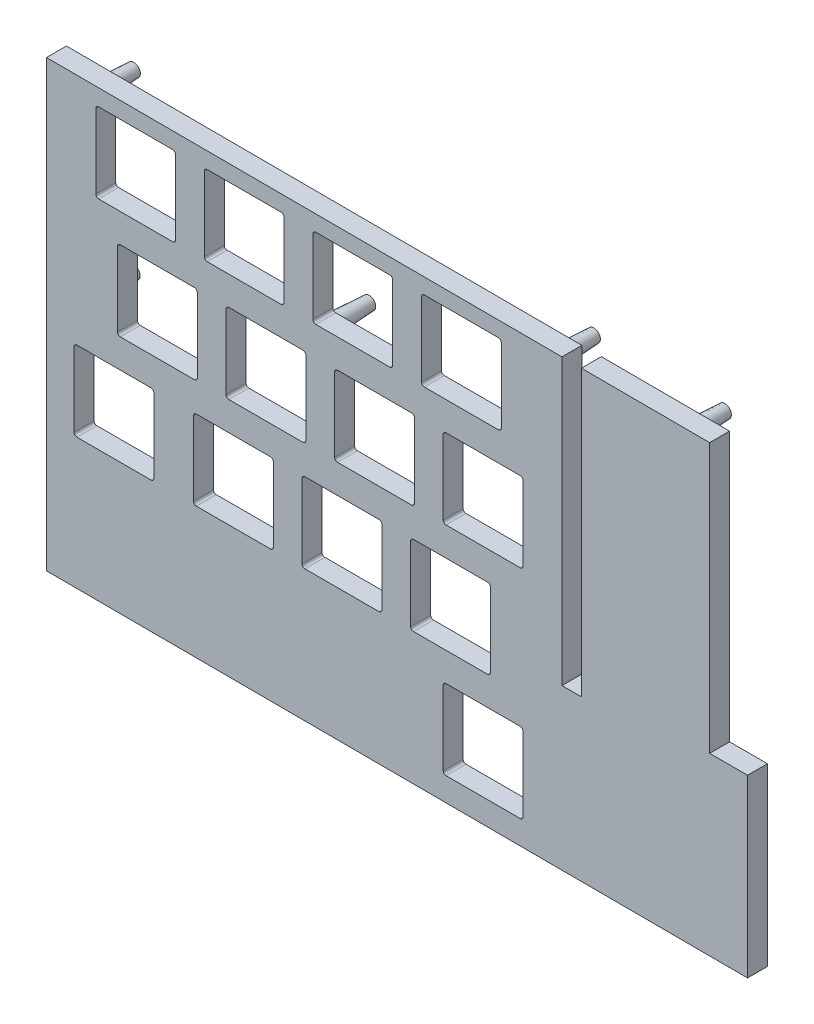
from build123d import *

# Parameters (mm, degrees)
BOSS_EXTRUDE1_DEPTH           = 3.5
SKETCH3_W                     = 3.410478587
SKETCH3_H                     = 49.945504098
SKETCH3_W_2                   = 6.648180457
SKETCH3_H_2                   = 47.210710856
CUT_EXTRUDE2_DEPTH            = 5
SKETCH4_R                     = 3.544423748
SKETCH4_R_2                   = 2.369129831
BOSS_EXTRUDE2_DEPTH           = 8
SKETCH6_R                     = 1.5
SKETCH6_R_2                   = 0.176517674
BOSS_EXTRUDE3_DEPTH           = 7
BOSS_EXTRUDE3_DRAFT           = 3
SKETCH6_R_3                   = 1.48523274
SKETCH6_R_4                   = 0.207886925
BOSS_EXTRUDE3_PROFILE_2_DEPTH = 7
BOSS_EXTRUDE3_PROFILE_2_DRAFT = 3
SKETCH6_R_5                   = 1.502064375
SKETCH6_R_6                   = 0.195980892
BOSS_EXTRUDE3_PROFILE_3_DEPTH = 7
BOSS_EXTRUDE3_PROFILE_3_DRAFT = 3
SKETCH6_R_7                   = 1.509002503
SKETCH6_R_8                   = 0.248242845
BOSS_EXTRUDE3_PROFILE_4_DEPTH = 7
BOSS_EXTRUDE3_PROFILE_4_DRAFT = 3
SKETCH6_R_9                   = 0.26800322
BOSS_EXTRUDE3_PROFILE_5_DEPTH = 7
BOSS_EXTRUDE3_PROFILE_5_DRAFT = 3
SKETCH6_R_10                  = 0.26114424
BOSS_EXTRUDE3_PROFILE_6_DEPTH = 7
BOSS_EXTRUDE3_PROFILE_6_DRAFT = 3
SKETCH6_R_11                  = 0.245265587
BOSS_EXTRUDE3_PROFILE_7_DEPTH = 7
BOSS_EXTRUDE3_PROFILE_7_DRAFT = 3
SKETCH6_R_12                  = 1.479730479
SKETCH6_R_13                  = 0.2681262
BOSS_EXTRUDE3_PROFILE_8_DEPTH = 7
BOSS_EXTRUDE3_PROFILE_8_DRAFT = 3
FILLET1_R                     = 1


with BuildPart() as part:
    # Model → Boss-Extrude1 (new body)
    with BuildSketch(Plane.XY):
        Polygon((0, -78), (123, -78.361463573), (123, -0.361463573), (0, 0), align=None)
        with BuildLine():
            Line((9.144975253, -2.923037489), (22.144975253, -2.923037489))
            ThreePointArc((22.144975253, -2.923037489), (22.498528643, -3.069484099), (22.644975253, -3.423037489))
            Line((22.644975253, -3.423037489), (22.644975253, -16.423037489))
            ThreePointArc((22.644975253, -16.423037489), (22.498528643, -16.77659088), (22.144975253, -16.923037489))
            Line((22.144975253, -16.923037489), (9.144975253, -16.923037489))
            ThreePointArc((9.144975253, -16.923037489), (8.791421862, -16.77659088), (8.644975253, -16.423037489))
            Line((8.644975253, -16.423037489), (8.644975253, -3.423037489))
            ThreePointArc((8.644975253, -3.423037489), (8.791421862, -3.069484099), (9.144975253, -2.923037489))
        make_face(mode=Mode.SUBTRACT)
        with BuildLine():
            Line((28.194975253, -2.923037489), (41.194975253, -2.923037489))
            ThreePointArc((41.194975253, -2.923037489), (41.548528643, -3.069484099), (41.694975253, -3.423037489))
            Line((41.694975253, -3.423037489), (41.694975253, -16.423037489))
            ThreePointArc((41.694975253, -16.423037489), (41.548528643, -16.77659088), (41.194975253, -16.923037489))
            Line((41.194975253, -16.923037489), (28.194975253, -16.923037489))
            ThreePointArc((28.194975253, -16.923037489), (27.841421862, -16.77659088), (27.694975253, -16.423037489))
            Line((27.694975253, -16.423037489), (27.694975253, -3.423037489))
            ThreePointArc((27.694975253, -3.423037489), (27.841421862, -3.069484099), (28.194975253, -2.923037489))
        make_face(mode=Mode.SUBTRACT)
        with BuildLine():
            Line((47.244975253, -2.923037489), (60.244975253, -2.923037489))
            ThreePointArc((60.244975253, -2.923037489), (60.598528643, -3.069484099), (60.744975253, -3.423037489))
            Line((60.744975253, -3.423037489), (60.744975253, -16.423037489))
            ThreePointArc((60.744975253, -16.423037489), (60.598528643, -16.77659088), (60.244975253, -16.923037489))
            Line((60.244975253, -16.923037489), (47.244975253, -16.923037489))
            ThreePointArc((47.244975253, -16.923037489), (46.891421862, -16.77659088), (46.744975253, -16.423037489))
            Line((46.744975253, -16.423037489), (46.744975253, -3.423037489))
            ThreePointArc((46.744975253, -3.423037489), (46.891421862, -3.069484099), (47.244975253, -2.923037489))
        make_face(mode=Mode.SUBTRACT)
        with BuildLine():
            Line((66.294975253, -2.923037489), (79.294975253, -2.923037489))
            ThreePointArc((79.294975253, -2.923037489), (79.648528643, -3.069484099), (79.794975253, -3.423037489))
            Line((79.794975253, -3.423037489), (79.794975253, -16.423037489))
            ThreePointArc((79.794975253, -16.423037489), (79.648528643, -16.77659088), (79.294975253, -16.923037489))
            Line((79.294975253, -16.923037489), (66.294975253, -16.923037489))
            ThreePointArc((66.294975253, -16.923037489), (65.941421862, -16.77659088), (65.794975253, -16.423037489))
            Line((65.794975253, -16.423037489), (65.794975253, -3.423037489))
            ThreePointArc((65.794975253, -3.423037489), (65.941421862, -3.069484099), (66.294975253, -2.923037489))
        make_face(mode=Mode.SUBTRACT)
        with BuildLine():
            Line((12.954975253, -21.973037489), (25.954975253, -21.973037489))
            ThreePointArc((25.954975253, -21.973037489), (26.308528643, -22.119484099), (26.454975253, -22.473037489))
            Line((26.454975253, -22.473037489), (26.454975253, -35.473037489))
            ThreePointArc((26.454975253, -35.473037489), (26.308528643, -35.82659088), (25.954975253, -35.973037489))
            Line((25.954975253, -35.973037489), (12.954975253, -35.973037489))
            ThreePointArc((12.954975253, -35.973037489), (12.601421862, -35.82659088), (12.454975253, -35.473037489))
            Line((12.454975253, -35.473037489), (12.454975253, -22.473037489))
            ThreePointArc((12.454975253, -22.473037489), (12.601421862, -22.119484099), (12.954975253, -21.973037489))
        make_face(mode=Mode.SUBTRACT)
        with BuildLine():
            Line((32.004975253, -21.973037489), (45.004975253, -21.973037489))
            ThreePointArc((45.004975253, -21.973037489), (45.358528643, -22.119484099), (45.504975253, -22.473037489))
            Line((45.504975253, -22.473037489), (45.504975253, -35.473037489))
            ThreePointArc((45.504975253, -35.473037489), (45.358528643, -35.82659088), (45.004975253, -35.973037489))
            Line((45.004975253, -35.973037489), (32.004975253, -35.973037489))
            ThreePointArc((32.004975253, -35.973037489), (31.651421862, -35.82659088), (31.504975253, -35.473037489))
            Line((31.504975253, -35.473037489), (31.504975253, -22.473037489))
            ThreePointArc((31.504975253, -22.473037489), (31.651421862, -22.119484099), (32.004975253, -21.973037489))
        make_face(mode=Mode.SUBTRACT)
        with BuildLine():
            Line((51.054975253, -21.973037489), (64.054975253, -21.973037489))
            ThreePointArc((64.054975253, -21.973037489), (64.408528643, -22.119484099), (64.554975253, -22.473037489))
            Line((64.554975253, -22.473037489), (64.554975253, -35.473037489))
            ThreePointArc((64.554975253, -35.473037489), (64.408528643, -35.82659088), (64.054975253, -35.973037489))
            Line((64.054975253, -35.973037489), (51.054975253, -35.973037489))
            ThreePointArc((51.054975253, -35.973037489), (50.701421862, -35.82659088), (50.554975253, -35.473037489))
            Line((50.554975253, -35.473037489), (50.554975253, -22.473037489))
            ThreePointArc((50.554975253, -22.473037489), (50.701421862, -22.119484099), (51.054975253, -21.973037489))
        make_face(mode=Mode.SUBTRACT)
        with BuildLine():
            Line((70.104975253, -21.973037489), (83.104975253, -21.973037489))
            ThreePointArc((83.104975253, -21.973037489), (83.458528643, -22.119484099), (83.604975253, -22.473037489))
            Line((83.604975253, -22.473037489), (83.604975253, -35.473037489))
            ThreePointArc((83.604975253, -35.473037489), (83.458528643, -35.82659088), (83.104975253, -35.973037489))
            Line((83.104975253, -35.973037489), (70.104975253, -35.973037489))
            ThreePointArc((70.104975253, -35.973037489), (69.751421862, -35.82659088), (69.604975253, -35.473037489))
            Line((69.604975253, -35.473037489), (69.604975253, -22.473037489))
            ThreePointArc((69.604975253, -22.473037489), (69.751421862, -22.119484099), (70.104975253, -21.973037489))
        make_face(mode=Mode.SUBTRACT)
        with BuildLine():
            Line((5.334975253, -41.023037489), (18.334975253, -41.023037489))
            ThreePointArc((18.334975253, -41.023037489), (18.688528643, -41.169484099), (18.834975253, -41.523037489))
            Line((18.834975253, -41.523037489), (18.834975253, -54.523037489))
            ThreePointArc((18.834975253, -54.523037489), (18.688528643, -54.87659088), (18.334975253, -55.023037489))
            Line((18.334975253, -55.023037489), (5.334975253, -55.023037489))
            ThreePointArc((5.334975253, -55.023037489), (4.981421862, -54.87659088), (4.834975253, -54.523037489))
            Line((4.834975253, -54.523037489), (4.834975253, -41.523037489))
            ThreePointArc((4.834975253, -41.523037489), (4.981421862, -41.169484099), (5.334975253, -41.023037489))
        make_face(mode=Mode.SUBTRACT)
        with BuildLine():
            Line((26.289975253, -41.023037489), (39.289975253, -41.023037489))
            ThreePointArc((39.289975253, -41.023037489), (39.643528643, -41.169484099), (39.789975253, -41.523037489))
            Line((39.789975253, -41.523037489), (39.789975253, -54.523037489))
            ThreePointArc((39.789975253, -54.523037489), (39.643528643, -54.87659088), (39.289975253, -55.023037489))
            Line((39.289975253, -55.023037489), (26.289975253, -55.023037489))
            ThreePointArc((26.289975253, -55.023037489), (25.936421862, -54.87659088), (25.789975253, -54.523037489))
            Line((25.789975253, -54.523037489), (25.789975253, -41.523037489))
            ThreePointArc((25.789975253, -41.523037489), (25.936421862, -41.169484099), (26.289975253, -41.023037489))
        make_face(mode=Mode.SUBTRACT)
        with BuildLine():
            Line((45.339975253, -41.023037489), (58.339975253, -41.023037489))
            ThreePointArc((58.339975253, -41.023037489), (58.693528643, -41.169484099), (58.839975253, -41.523037489))
            Line((58.839975253, -41.523037489), (58.839975253, -54.523037489))
            ThreePointArc((58.839975253, -54.523037489), (58.693528643, -54.87659088), (58.339975253, -55.023037489))
            Line((58.339975253, -55.023037489), (45.339975253, -55.023037489))
            ThreePointArc((45.339975253, -55.023037489), (44.986421862, -54.87659088), (44.839975253, -54.523037489))
            Line((44.839975253, -54.523037489), (44.839975253, -41.523037489))
            ThreePointArc((44.839975253, -41.523037489), (44.986421862, -41.169484099), (45.339975253, -41.023037489))
        make_face(mode=Mode.SUBTRACT)
        with BuildLine():
            Line((64.389975253, -41.023037489), (77.389975253, -41.023037489))
            ThreePointArc((77.389975253, -41.023037489), (77.743528643, -41.169484099), (77.889975253, -41.523037489))
            Line((77.889975253, -41.523037489), (77.889975253, -54.523037489))
            ThreePointArc((77.889975253, -54.523037489), (77.743528643, -54.87659088), (77.389975253, -55.023037489))
            Line((77.389975253, -55.023037489), (64.389975253, -55.023037489))
            ThreePointArc((64.389975253, -55.023037489), (64.036421862, -54.87659088), (63.889975253, -54.523037489))
            Line((63.889975253, -54.523037489), (63.889975253, -41.523037489))
            ThreePointArc((63.889975253, -41.523037489), (64.036421862, -41.169484099), (64.389975253, -41.023037489))
        make_face(mode=Mode.SUBTRACT)
        with BuildLine():
            Line((70.104975253, -60.073037489), (83.104975253, -60.073037489))
            ThreePointArc((83.104975253, -60.073037489), (83.458528643, -60.219484099), (83.604975253, -60.573037489))
            Line((83.604975253, -60.573037489), (83.604975253, -73.573037489))
            ThreePointArc((83.604975253, -73.573037489), (83.458528643, -73.92659088), (83.104975253, -74.073037489))
            Line((83.104975253, -74.073037489), (70.104975253, -74.073037489))
            ThreePointArc((70.104975253, -74.073037489), (69.751421862, -73.92659088), (69.604975253, -73.573037489))
            Line((69.604975253, -73.573037489), (69.604975253, -60.573037489))
            ThreePointArc((69.604975253, -60.573037489), (69.751421862, -60.219484099), (70.104975253, -60.073037489))
        make_face(mode=Mode.SUBTRACT)
    extrude(amount=BOSS_EXTRUDE1_DEPTH)

    # Sketch3 → Cut-Extrude2 (cut)
    with BuildSketch(Plane.XY.offset(3.5)):
        with Locations((92.139427294, -25.238513551)):
            Rectangle(SKETCH3_W, SKETCH3_H)
        with Locations((119.675909772, -23.947281806)):
            Rectangle(SKETCH3_W_2, SKETCH3_H_2)
    extrude(amount=-CUT_EXTRUDE2_DEPTH, mode=Mode.SUBTRACT)

    # Sketch4 → Boss-Extrude2 (add)
    with BuildSketch(Plane.XY):
        with Locations((104.757578873, -16.130439743)):
            Circle(SKETCH4_R)
        with Locations((104.757578873, -16.130439743)):
            Circle(SKETCH4_R_2, mode=Mode.SUBTRACT)
    extrude(amount=-BOSS_EXTRUDE2_DEPTH)


with BuildPart() as boss_extrude3_tool:
    # Sketch6 → Boss-Extrude3 (with draft: the straight prism first)
    with BuildSketch(Plane(origin=(0, 0, 0), x_dir=(-1, 0, 0), z_dir=(0, 0, -1))):
        with Locations((-4.834975253, -70.100370509)):
            Circle(SKETCH6_R)
        with Locations((-4.834975253, -70.100370509)):
            Circle(SKETCH6_R_2, mode=Mode.SUBTRACT)
    extrude(amount=BOSS_EXTRUDE3_DEPTH)
    # Boss-Extrude3: the draft: its side faces are tilted about the plane it starts from
    boss_extrude3_sides = [boss_extrude3_tool.faces().sort_by_distance(p)[0] for p in [
        (6.334975253, -70.100370509, -3.5),
        (5.011492927, -70.100370509, -3.5),
    ]]
    draft(boss_extrude3_sides, Plane(origin=(0, 0, 0), x_dir=(-1, 0, 0), z_dir=(0, 0, -1)), BOSS_EXTRUDE3_DRAFT)


with BuildPart() as part_1:
    add(part.part)

    # Boss-Extrude3: add boss_extrude3_tool
    add(boss_extrude3_tool.part)


with BuildPart() as boss_extrude3_profile_2_tool:
    # Sketch6 → Boss-Extrude3 profile 2 (with draft: the straight prism first)
    with BuildSketch(Plane(origin=(0, 0, 0), x_dir=(-1, 0, 0), z_dir=(0, 0, -1))):
        with Locations((-58.638487404, -70.100370509)):
            Circle(SKETCH6_R_3)
        with Locations((-58.638487404, -70.100370509)):
            Circle(SKETCH6_R_4, mode=Mode.SUBTRACT)
    extrude(amount=BOSS_EXTRUDE3_PROFILE_2_DEPTH)
    # Boss-Extrude3 profile 2: the draft: its side faces are tilted about the plane it starts from
    boss_extrude3_profile_2_sides = [boss_extrude3_profile_2_tool.faces().sort_by_distance(p)[0] for p in [
        (60.123720144, -70.100370509, -3.5),
        (58.846374329, -70.100370509, -3.5),
    ]]
    draft(boss_extrude3_profile_2_sides, Plane(origin=(0, 0, 0), x_dir=(-1, 0, 0), z_dir=(0, 0, -1)), BOSS_EXTRUDE3_PROFILE_2_DRAFT)


with BuildPart() as part_2:
    add(part_1.part)

    # Boss-Extrude3 profile 2: add boss_extrude3_profile_2_tool
    add(boss_extrude3_profile_2_tool.part)


with BuildPart() as boss_extrude3_profile_3_tool:
    # Sketch6 → Boss-Extrude3 profile 3 (with draft: the straight prism first)
    with BuildSketch(Plane(origin=(0, 0, 0), x_dir=(-1, 0, 0), z_dir=(0, 0, -1))):
        with Locations((-112.441999555, -70.100370509)):
            Circle(SKETCH6_R_5)
        with Locations((-112.441999555, -70.100370509)):
            Circle(SKETCH6_R_6, mode=Mode.SUBTRACT)
    extrude(amount=BOSS_EXTRUDE3_PROFILE_3_DEPTH)
    # Boss-Extrude3 profile 3: the draft: its side faces are tilted about the plane it starts from
    boss_extrude3_profile_3_sides = [boss_extrude3_profile_3_tool.faces().sort_by_distance(p)[0] for p in [
        (113.94406393, -70.100370509, -3.5),
        (112.637980447, -70.100370509, -3.5),
    ]]
    draft(boss_extrude3_profile_3_sides, Plane(origin=(0, 0, 0), x_dir=(-1, 0, 0), z_dir=(0, 0, -1)), BOSS_EXTRUDE3_PROFILE_3_DRAFT)


with BuildPart() as part_3:
    add(part_2.part)

    # Boss-Extrude3 profile 3: add boss_extrude3_profile_3_tool
    add(boss_extrude3_profile_3_tool.part)


with BuildPart() as boss_extrude3_profile_4_tool:
    # Sketch6 → Boss-Extrude3 profile 4 (with draft: the straight prism first)
    with BuildSketch(Plane(origin=(0, 0, 0), x_dir=(-1, 0, 0), z_dir=(0, 0, -1))):
        with Locations((-108.518147983, -4.704019458)):
            Circle(SKETCH6_R_7)
        with Locations((-108.518147983, -4.704019458)):
            Circle(SKETCH6_R_8, mode=Mode.SUBTRACT)
    extrude(amount=BOSS_EXTRUDE3_PROFILE_4_DEPTH)
    # Boss-Extrude3 profile 4: the draft: its side faces are tilted about the plane it starts from
    boss_extrude3_profile_4_sides = [boss_extrude3_profile_4_tool.faces().sort_by_distance(p)[0] for p in [
        (110.027150487, -4.704019458, -3.5),
        (108.766390829, -4.704019458, -3.5),
    ]]
    draft(boss_extrude3_profile_4_sides, Plane(origin=(0, 0, 0), x_dir=(-1, 0, 0), z_dir=(0, 0, -1)), BOSS_EXTRUDE3_PROFILE_4_DRAFT)


with BuildPart() as part_4:
    add(part_3.part)

    # Boss-Extrude3 profile 4: add boss_extrude3_profile_4_tool
    add(boss_extrude3_profile_4_tool.part)


with BuildPart() as boss_extrude3_profile_5_tool:
    # Sketch6 → Boss-Extrude3 profile 5 (with draft: the straight prism first)
    with BuildSketch(Plane(origin=(0, 0, 0), x_dir=(-1, 0, 0), z_dir=(0, 0, -1))):
        with Locations((-85.542975253, -4.704019458)):
            Circle(SKETCH6_R)
        with Locations((-85.542975253, -4.704019458)):
            Circle(SKETCH6_R_9, mode=Mode.SUBTRACT)
    extrude(amount=BOSS_EXTRUDE3_PROFILE_5_DEPTH)
    # Boss-Extrude3 profile 5: the draft: its side faces are tilted about the plane it starts from
    boss_extrude3_profile_5_sides = [boss_extrude3_profile_5_tool.faces().sort_by_distance(p)[0] for p in [
        (87.042975253, -4.704019458, -3.5),
        (85.810978473, -4.704019458, -3.5),
    ]]
    draft(boss_extrude3_profile_5_sides, Plane(origin=(0, 0, 0), x_dir=(-1, 0, 0), z_dir=(0, 0, -1)), BOSS_EXTRUDE3_PROFILE_5_DRAFT)


with BuildPart() as part_5:
    add(part_4.part)

    # Boss-Extrude3 profile 5: add boss_extrude3_profile_5_tool
    add(boss_extrude3_profile_5_tool.part)


with BuildPart() as boss_extrude3_profile_6_tool:
    # Sketch6 → Boss-Extrude3 profile 6 (with draft: the straight prism first)
    with BuildSketch(Plane(origin=(0, 0, 0), x_dir=(-1, 0, 0), z_dir=(0, 0, -1))):
        with Locations((-46.124975253, -19.448037489)):
            Circle(SKETCH6_R)
        with Locations((-46.124975253, -19.448037489)):
            Circle(SKETCH6_R_10, mode=Mode.SUBTRACT)
    extrude(amount=BOSS_EXTRUDE3_PROFILE_6_DEPTH)
    # Boss-Extrude3 profile 6: the draft: its side faces are tilted about the plane it starts from
    boss_extrude3_profile_6_sides = [boss_extrude3_profile_6_tool.faces().sort_by_distance(p)[0] for p in [
        (47.624975253, -19.448037489, -3.5),
        (46.386119493, -19.448037489, -3.5),
    ]]
    draft(boss_extrude3_profile_6_sides, Plane(origin=(0, 0, 0), x_dir=(-1, 0, 0), z_dir=(0, 0, -1)), BOSS_EXTRUDE3_PROFILE_6_DRAFT)


with BuildPart() as part_6:
    add(part_5.part)

    # Boss-Extrude3 profile 6: add boss_extrude3_profile_6_tool
    add(boss_extrude3_profile_6_tool.part)


with BuildPart() as boss_extrude3_profile_7_tool:
    # Sketch6 → Boss-Extrude3 profile 7 (with draft: the straight prism first)
    with BuildSketch(Plane(origin=(0, 0, 0), x_dir=(-1, 0, 0), z_dir=(0, 0, -1))):
        with Locations((-4.834975253, -4.704019458)):
            Circle(SKETCH6_R)
        with Locations((-4.834975253, -4.704019458)):
            Circle(SKETCH6_R_11, mode=Mode.SUBTRACT)
    extrude(amount=BOSS_EXTRUDE3_PROFILE_7_DEPTH)
    # Boss-Extrude3 profile 7: the draft: its side faces are tilted about the plane it starts from
    boss_extrude3_profile_7_sides = [boss_extrude3_profile_7_tool.faces().sort_by_distance(p)[0] for p in [
        (6.334975253, -4.704019458, -3.5),
        (5.080240839, -4.704019458, -3.5),
    ]]
    draft(boss_extrude3_profile_7_sides, Plane(origin=(0, 0, 0), x_dir=(-1, 0, 0), z_dir=(0, 0, -1)), BOSS_EXTRUDE3_PROFILE_7_DRAFT)


with BuildPart() as part_7:
    add(part_6.part)

    # Boss-Extrude3 profile 7: add boss_extrude3_profile_7_tool
    add(boss_extrude3_profile_7_tool.part)


with BuildPart() as boss_extrude3_profile_8_tool:
    # Sketch6 → Boss-Extrude3 profile 8 (with draft: the straight prism first)
    with BuildSketch(Plane(origin=(0, 0, 0), x_dir=(-1, 0, 0), z_dir=(0, 0, -1))):
        with Locations((-4.834975253, -35.452591807)):
            Circle(SKETCH6_R_12)
        with Locations((-4.834975253, -35.452591807)):
            Circle(SKETCH6_R_13, mode=Mode.SUBTRACT)
    extrude(amount=BOSS_EXTRUDE3_PROFILE_8_DEPTH)
    # Boss-Extrude3 profile 8: the draft: its side faces are tilted about the plane it starts from
    boss_extrude3_profile_8_sides = [boss_extrude3_profile_8_tool.faces().sort_by_distance(p)[0] for p in [
        (6.314705732, -35.452591807, -3.5),
        (5.103101453, -35.452591807, -3.5),
    ]]
    draft(boss_extrude3_profile_8_sides, Plane(origin=(0, 0, 0), x_dir=(-1, 0, 0), z_dir=(0, 0, -1)), BOSS_EXTRUDE3_PROFILE_8_DRAFT)


with BuildPart() as part_8:
    add(part_7.part)

    # Boss-Extrude3 profile 8: add boss_extrude3_profile_8_tool
    add(boss_extrude3_profile_8_tool.part)

    # Fillet1
    fillet1_edges = [part_8.edges().sort_by_distance(p)[0] for p in [
        (101.213155125, -16.130439743, 0),
        (6.334975253, -70.100370509, 0),
        (60.123720144, -70.100370509, 0),
        (113.94406393, -70.100370509, 0),
        (110.027150487, -4.704019458, 0),
        (87.042975253, -4.704019458, 0),
        (47.624975253, -19.448037489, 0),
        (6.334975253, -4.704019458, 0),
        (6.314705732, -35.452591807, 0),
    ]]
    fillet(fillet1_edges, radius=FILLET1_R)


solid = part_8.part
